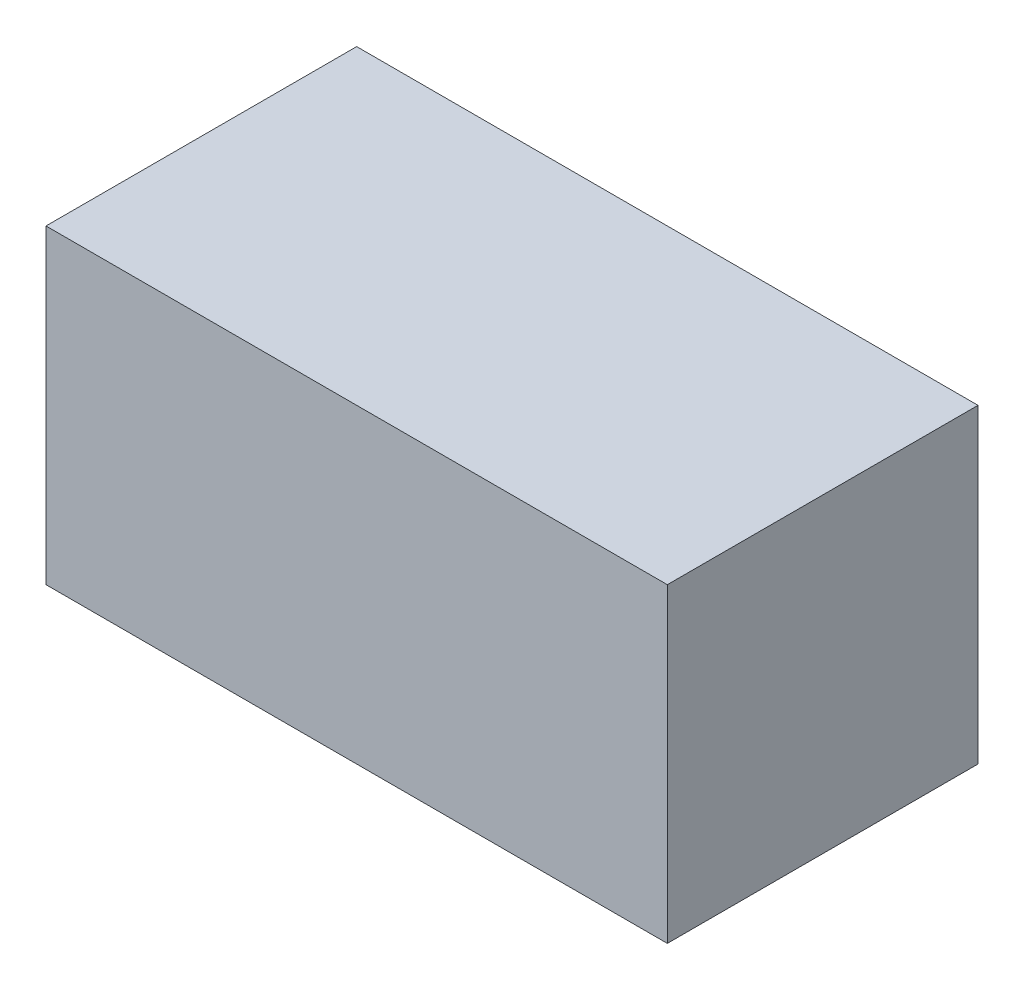
from build123d import *

# Parameters (mm, degrees)
SKETCH1_W           = 20
SKETCH1_H           = 10
BOSS_EXTRUDE1_DEPTH = 10


with BuildPart() as part:
    # Sketch1 → Boss-Extrude1 (new body)
    with BuildSketch(Plane.XY):
        with Locations((10, 5)):
            Rectangle(SKETCH1_W, SKETCH1_H)
    extrude(amount=BOSS_EXTRUDE1_DEPTH)


solid = part.part
